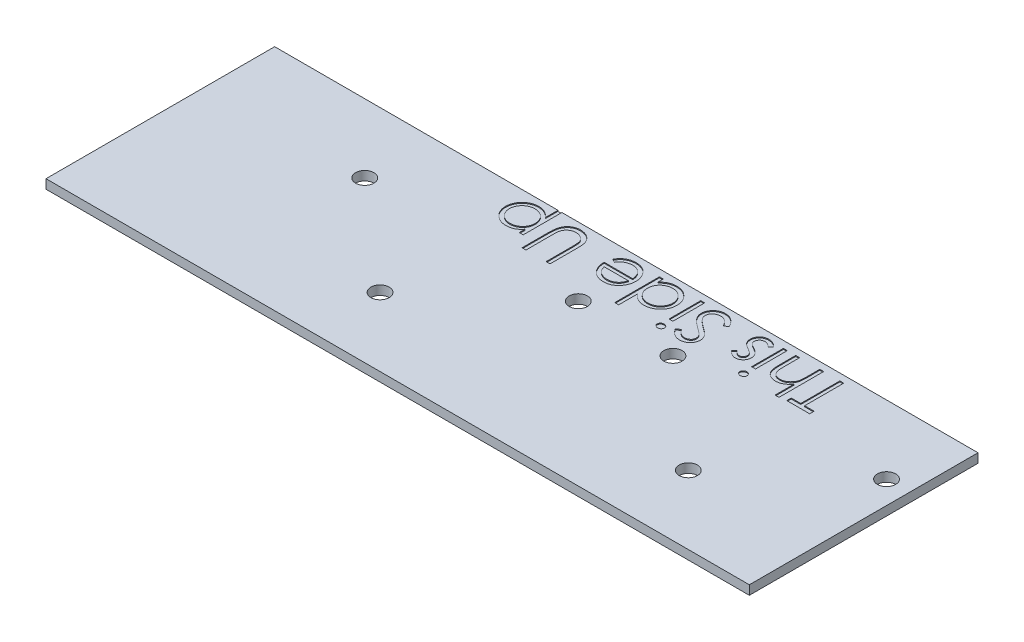
from build123d import *

# Parameters (mm, degrees)
SKETCH1_W           = 56.7
SKETCH1_H           = 50
SKETCH1_R           = 2
SKETCH1_W_2         = 8.7
SKETCH1_W_3         = 2
SKETCH1_W_4         = 29.7
BOSS_EXTRUDE1_DEPTH = 2
SKETCH2_W           = 0.854807693
SKETCH2_H           = 6.960576923
CUT_EXTRUDE1_DEPTH  = 0.2


with BuildPart() as part:
    # Sketch1 → Boss-Extrude1 (new body)
    # profile 1 of 5: a face of its own
    with BuildSketch(Plane(origin=(0, 0, 0), x_dir=(1, 0, 0), z_dir=(0, 1, 0))):
        Rectangle(SKETCH1_W, SKETCH1_H)
        with Locations(Location((23.35, 10, 0), (0, 0, 270))):
            Circle(SKETCH1_R, mode=Mode.SUBTRACT)
        with Locations(Location((0, -10, 0), (0, 0, 270))):
            Circle(SKETCH1_R, mode=Mode.SUBTRACT)
        with Locations(Location((-23.35, 10, 0), (0, 0, 270))):
            Circle(SKETCH1_R, mode=Mode.SUBTRACT)
    # profile 2 of 5: a face of its own
    with BuildSketch(Plane(origin=(0, 0, 0), x_dir=(1, 0, 0), z_dir=(0, 1, 0))):
        with Locations((32.7, 0)):
            Rectangle(SKETCH1_W_2, SKETCH1_H)
    # profile 3 of 5: a face of its own
    with BuildSketch(Plane(origin=(0, 0, 0), x_dir=(1, 0, 0), z_dir=(0, 1, 0))):
        with Locations((67.4, 0)):
            Rectangle(SKETCH1_W, SKETCH1_H)
        with Locations(Location((90.75, 10, 0), (0, 0, 270))):
            Circle(SKETCH1_R, mode=Mode.SUBTRACT)
        with Locations(Location((67.4, -10, 0), (0, 0, 270))):
            Circle(SKETCH1_R, mode=Mode.SUBTRACT)
        with Locations(Location((44.05, 10, 0), (0, 0, 270))):
            Circle(SKETCH1_R, mode=Mode.SUBTRACT)
    # profile 4 of 5: a face of its own
    with BuildSketch(Plane(origin=(0, 0, 0), x_dir=(1, 0, 0), z_dir=(0, 1, 0))):
        with Locations((38.05, 0)):
            Rectangle(SKETCH1_W_3, SKETCH1_H)
    # profile 5 of 5: a face of its own
    with BuildSketch(Plane(origin=(0, 0, 0), x_dir=(1, 0, 0), z_dir=(0, 1, 0))):
        with Locations((-43.2, 0)):
            Rectangle(SKETCH1_W_4, SKETCH1_H)
    extrude(amount=BOSS_EXTRUDE1_DEPTH)

    # Sketch2 → Cut-Extrude1 (cut)
    # profile 1 of 12: a face of its own
    with BuildSketch(Plane(origin=(0, 2, 0), x_dir=(1, 0, 0), z_dir=(0, 1, 0))):
        with BuildLine():
            Line((4.759615385, 16.539423077), (3.904807692, 16.539423077))
            Line((3.904807692, 16.539423077), (3.904807692, 17.827358774))
            add(Edge.make_bspline(
                [(3.904807692, 17.827358774), (3.813743751, 17.711435136), (3.636217432, 17.485445611), (3.334891802, 17.188412777), (3.009625504, 16.944809007), (2.665842405, 16.747320075), (2.300156627, 16.600726472), (1.916667217, 16.492715786), (1.5110623, 16.428897878), (1.233759293, 16.421222204), (1.09233774, 16.417307692)],
                knots=[0, 0, 0, 0, 1.079470681, 2.104394496, 3.089609837, 4.049760214, 5.000876222, 5.968810619, 6.964115249, 8, 8, 8, 8], degree=3))
            add(Edge.make_bspline(
                [(1.09233774, 16.417307692), (0.968807735, 16.420881415), (0.724644189, 16.427945065), (0.365243544, 16.475768878), (0.019144822, 16.557732027), (-0.311693954, 16.675844518), (-0.63081701, 16.821864047), (-0.93350001, 17.006151122), (-1.224457615, 17.21952797), (-1.496372387, 17.465088323), (-1.747618394, 17.730776677), (-1.964914073, 18.016587376), (-2.152344041, 18.313121272), (-2.303846776, 18.624975466), (-2.422523779, 18.949694227), (-2.506928009, 19.288589484), (-2.557159167, 19.640404722), (-2.563898653, 19.879625697), (-2.567307692, 20.00063101)],
                knots=[0, 0, 0, 0, 1.041296284, 2.058176809, 3.050446431, 4.034000596, 5.01514041, 6.003636468, 7.015969324, 8.052561599, 9.08815499, 10.094063707, 11.074456064, 12.040834395, 13.011057502, 13.983766392, 14.980127149, 16, 16, 16, 16], degree=3))
            add(Edge.make_bspline(
                [(-2.567307692, 20.00063101), (-2.56399116, 20.124197219), (-2.557450479, 20.367887615), (-2.506171134, 20.725618866), (-2.425575201, 21.070427212), (-2.304768233, 21.399031178), (-2.156859662, 21.716185117), (-1.971794206, 22.016529091), (-1.754652263, 22.302926359), (-1.506106127, 22.570545784), (-1.236573931, 22.817144497), (-0.948381668, 23.032673792), (-0.645829282, 23.214455158), (-0.330363027, 23.364178519), (-0.000880744, 23.479575436), (0.342439899, 23.561267019), (0.699673309, 23.612089542), (0.942705705, 23.61874781), (1.065625, 23.622115385)],
                knots=[0, 0, 0, 0, 1.038787011, 2.048637893, 3.033314735, 4.011256821, 4.987456671, 5.971770257, 6.972013799, 8.005388554, 9.039095487, 10.040396776, 11.026510796, 12.002710647, 12.972028308, 13.95670515, 14.966556032, 16, 16, 16, 16], degree=3))
            add(Edge.make_bspline(
                [(1.065625, 23.622115385), (1.204550969, 23.618419288), (1.477618712, 23.611154378), (1.878331032, 23.543578644), (2.261788631, 23.435885309), (2.627051407, 23.280379785), (2.976667424, 23.086058555), (3.305684376, 22.843506975), (3.621324961, 22.563848295), (3.80914146, 22.348478053), (3.904807692, 22.238777043)],
                knots=[0, 0, 0, 0, 1.019216655, 2.003334536, 2.974394125, 3.93700843, 4.911195144, 5.904014639, 6.932388669, 8, 8, 8, 8], degree=3))
            Line((3.904807692, 22.238777043), (3.904807692, 26.064423077))
            Line((3.904807692, 26.064423077), (4.759615385, 26.064423077))
            Line((4.759615385, 26.064423077), (4.759615385, 16.539423077))
        make_face()
        with BuildLine():
            add(Edge.make_bspline(
                [(1.099969952, 17.272115385), (1.196795901, 17.273860397), (1.387421237, 17.277295876), (1.666854766, 17.318009321), (1.935924096, 17.377302973), (2.191769227, 17.466182517), (2.436472021, 17.577873406), (2.670457039, 17.712825709), (2.889789325, 17.877102678), (3.097067483, 18.061143265), (3.286431821, 18.262918336), (3.452181652, 18.480233147), (3.591648786, 18.710095238), (3.707285781, 18.951309101), (3.795313573, 19.205606705), (3.857783765, 19.471582059), (3.897055529, 19.749514803), (3.902196056, 19.93880658), (3.904807692, 20.034975962)],
                knots=[0, 0, 0, 0, 1.056783697, 2.080534709, 3.078213817, 4.062450963, 5.032388505, 6.013014931, 7.006476528, 8.020136409, 9.037574406, 10.02408906, 10.99988041, 11.969394914, 12.94050107, 13.932990591, 14.949859205, 16, 16, 16, 16], degree=3))
            add(Edge.make_bspline(
                [(3.904807692, 20.034975962), (3.900403353, 20.161193601), (3.891774879, 20.408464646), (3.82395687, 20.769775589), (3.708014756, 21.110093649), (3.549271044, 21.429914641), (3.349503082, 21.724431521), (3.107123907, 21.987198055), (2.826300967, 22.217313825), (2.510500905, 22.41190369), (2.171449527, 22.568967654), (1.81902694, 22.685000153), (1.455642582, 22.75386247), (1.210289347, 22.762801683), (1.086613582, 22.767307692)],
                knots=[0, 0, 0, 0, 1.03769607, 2.032934487, 3.010626162, 3.986202239, 4.961259226, 5.927576439, 6.916221152, 7.938198981, 8.97036853, 9.982809098, 10.983189979, 12, 12, 12, 12], degree=3))
            add(Edge.make_bspline(
                [(1.086613582, 22.767307692), (0.965412861, 22.763071966), (0.724851219, 22.754664811), (0.37063238, 22.681901069), (0.026407892, 22.570735349), (-0.300694747, 22.408682133), (-0.607582697, 22.209918085), (-0.885776651, 21.971786645), (-1.126340846, 21.693114106), (-1.335846583, 21.386759297), (-1.501854969, 21.05709268), (-1.624862029, 20.716099874), (-1.697233019, 20.365565961), (-1.707404349, 20.128791153), (-1.7125, 20.010171274)],
                knots=[0, 0, 0, 0, 1.001026069, 1.986856787, 2.977862212, 3.984342003, 4.995015878, 5.994217425, 7.000312571, 8.029930354, 9.055188864, 10.043064731, 11.019610969, 12, 12, 12, 12], degree=3))
            add(Edge.make_bspline(
                [(-1.7125, 20.010171274), (-1.708524162, 19.890832777), (-1.700603462, 19.65308555), (-1.623166651, 19.30252143), (-1.505534891, 18.960761923), (-1.339302557, 18.633721605), (-1.132230775, 18.330337766), (-0.891448957, 18.056558666), (-0.614545132, 17.822182073), (-0.310057326, 17.623251799), (0.019951951, 17.467993435), (0.366280181, 17.353800729), (0.728388818, 17.285347886), (0.97502005, 17.276565018), (1.099969952, 17.272115385)],
                knots=[0, 0, 0, 0, 0.983964174, 1.960262275, 2.950024098, 3.962167997, 4.978769863, 5.975637987, 6.962679854, 7.964734575, 8.970044757, 9.964711476, 10.968869031, 12, 12, 12, 12], degree=3))
        make_face(mode=Mode.SUBTRACT)
    # profile 2 of 12: a face of its own
    with BuildSketch(Plane(origin=(0, 2, 0), x_dir=(1, 0, 0), z_dir=(0, 1, 0))):
        with BuildLine():
            Line((13.185576923, 13.975), (12.330769231, 13.975))
            Line((12.330769231, 13.975), (12.330769231, 19.681986178))
            add(Edge.make_bspline(
                [(12.330769231, 19.681986178), (12.330896441, 19.76276018), (12.331137845, 19.916042769), (12.329525361, 20.134215073), (12.325009508, 20.328177979), (12.322162459, 20.498679147), (12.315828787, 20.644936195), (12.310663388, 20.767741505), (12.304021588, 20.866513584), (12.296039318, 20.924155962), (12.292608173, 20.948933293)],
                knots=[0, 0, 0, 0, 1.528628734, 2.90083645, 4.128790002, 5.200304208, 6.127813768, 6.898992206, 7.526736466, 8, 8, 8, 8], degree=3))
            add(Edge.make_bspline(
                [(12.292608173, 20.948933293), (12.278692431, 21.039016706), (12.251828717, 21.212918684), (12.18019884, 21.460251276), (12.085485292, 21.684341852), (11.964781153, 21.88769417), (11.815908114, 22.071738016), (11.632228331, 22.238242846), (11.414120914, 22.387688343), (11.166545215, 22.518778605), (10.902589952, 22.627502161), (10.631914266, 22.708895306), (10.359688775, 22.758698925), (10.177413427, 22.764451217), (10.086899038, 22.767307692)],
                knots=[0, 0, 0, 0, 1.042923073, 2.013316119, 2.939979093, 3.821796737, 4.712412725, 5.640305549, 6.650442997, 7.732186751, 8.842579391, 9.91407549, 10.964170509, 12, 12, 12, 12], degree=3))
            add(Edge.make_bspline(
                [(10.086899038, 22.767307692), (10.009185101, 22.764401647), (9.854206081, 22.75860634), (9.624059569, 22.722272631), (9.399191647, 22.658094841), (9.181417359, 22.57062561), (8.974095271, 22.463233304), (8.782799364, 22.333688992), (8.609544173, 22.184991754), (8.453300428, 22.017838212), (8.317304556, 21.831204056), (8.200232715, 21.626061661), (8.104578823, 21.400774832), (8.056525724, 21.242005402), (8.031926082, 21.160727163)],
                knots=[0, 0, 0, 0, 0.994543961, 1.983343699, 2.972712664, 3.980751554, 4.981834161, 5.954730495, 6.930176574, 7.89761099, 8.875938748, 9.87834379, 10.913868493, 12, 12, 12, 12], degree=3))
            add(Edge.make_bspline(
                [(8.031926082, 21.160727163), (8.023761455, 21.1271214), (8.005567376, 21.052234217), (7.98856649, 20.925629848), (7.970859446, 20.776252365), (7.958573366, 20.603028503), (7.946595759, 20.406538713), (7.939430039, 20.185759398), (7.936117971, 19.94149224), (7.935130962, 19.771029679), (7.934615385, 19.681986178)],
                knots=[0, 0, 0, 0, 0.558680831, 1.244966039, 2.062412453, 2.990489873, 4.051219941, 5.244515665, 6.560634259, 8, 8, 8, 8], degree=3))
            Line((7.934615385, 19.681986178), (7.934615385, 13.975))
            Line((7.934615385, 13.975), (7.079807692, 13.975))
            Line((7.079807692, 13.975), (7.079807692, 19.727779447))
            add(Edge.make_bspline(
                [(7.079807692, 19.727779447), (7.080491714, 19.831462562), (7.081826624, 20.033806464), (7.093635203, 20.330294558), (7.111925571, 20.611616177), (7.139554457, 20.877417429), (7.170125586, 21.127997449), (7.213496289, 21.36243843), (7.259619824, 21.582729255), (7.317504225, 21.789276252), (7.386360952, 21.985195945), (7.468359439, 22.174188866), (7.568228933, 22.354554605), (7.681274798, 22.529599596), (7.809811551, 22.697710674), (7.952743187, 22.860192354), (8.11235739, 23.014908593), (8.284631413, 23.162599061), (8.468166574, 23.300923236), (8.665021969, 23.418694927), (8.871673841, 23.518366896), (9.085930521, 23.603260043), (9.311413267, 23.665338335), (9.545313461, 23.711945724), (9.789274963, 23.738311635), (9.95518388, 23.742240998), (10.039197716, 23.744230769)],
                knots=[0, 0, 0, 0, 1.316485072, 2.56920066, 3.767172097, 4.895413872, 5.962239305, 6.971350037, 7.921780903, 8.819233545, 9.69278517, 10.557066787, 11.431700348, 12.307563454, 13.200791052, 14.11626757, 15.05287325, 16.020813301, 16.99640464, 17.967304965, 18.928075993, 19.907403966, 20.889159767, 21.893313923, 22.933205135, 24, 24, 24, 24], degree=3))
            add(Edge.make_bspline(
                [(10.039197716, 23.744230769), (10.130826443, 23.742096567), (10.310601678, 23.737909269), (10.575490797, 23.713877822), (10.829473259, 23.668728438), (11.075027867, 23.610867298), (11.309782289, 23.532369042), (11.533667346, 23.435915622), (11.749253704, 23.325799388), (11.951684255, 23.195679696), (12.142619599, 23.053792931), (12.316136171, 22.897945876), (12.476638703, 22.734073988), (12.617052601, 22.556006663), (12.742688787, 22.367389105), (12.850778803, 22.167334155), (12.943624349, 21.956109999), (12.99153817, 21.809279057), (13.015760216, 21.735051082)],
                knots=[0, 0, 0, 0, 1.138939089, 2.234594419, 3.301501784, 4.342532435, 5.367382236, 6.373123747, 7.370098489, 8.372230273, 9.360297234, 10.323289009, 11.268038109, 12.20748145, 13.137029304, 14.081414587, 15.030090602, 16, 16, 16, 16], degree=3))
            add(Edge.make_bspline(
                [(13.015760216, 21.735051082), (13.029849483, 21.684343861), (13.060409415, 21.574358771), (13.093135403, 21.39233197), (13.120646547, 21.182741372), (13.146515245, 20.945572633), (13.161779623, 20.680641924), (13.175162081, 20.388064089), (13.185671201, 20.06748535), (13.185609227, 19.844179847), (13.185576923, 19.727779447)],
                knots=[0, 0, 0, 0, 0.625038921, 1.35572334, 2.194682327, 3.136881307, 4.189498639, 5.346923369, 6.617055217, 8, 8, 8, 8], degree=3))
            Line((13.185576923, 19.727779447), (13.185576923, 13.975))
        make_face()
    # profile 3 of 12: a face of its own
    with BuildSketch(Plane(origin=(0, 2, 0), x_dir=(1, 0, 0), z_dir=(0, 1, 0))):
        with BuildLine():
            Line((19.928635817, 21.301923077), (19.169230769, 21.70070613))
            add(Edge.make_bspline(
                [(19.169230769, 21.70070613), (19.229786542, 21.808014101), (19.347604095, 22.016792919), (19.549242508, 22.303790425), (19.762809869, 22.559555686), (19.992550372, 22.78288801), (20.235581989, 22.97903384), (20.495523958, 23.147101901), (20.768051004, 23.293024512), (21.057116056, 23.4119594), (21.362443304, 23.505574126), (21.685913746, 23.574679147), (22.029024231, 23.614760651), (22.263987035, 23.61962473), (22.38429988, 23.622115385)],
                knots=[0, 0, 0, 0, 1.120547187, 2.180141081, 3.186367408, 4.148075574, 5.090720713, 6.023293347, 6.960451315, 7.899733127, 8.862572377, 9.862522039, 10.90550313, 12, 12, 12, 12], degree=3))
            add(Edge.make_bspline(
                [(22.38429988, 23.622115385), (22.518036261, 23.618993429), (22.778917196, 23.612903397), (23.158664662, 23.560400337), (23.516204324, 23.474750545), (23.85151632, 23.355101523), (24.163778638, 23.198816949), (24.453615063, 23.008428008), (24.722537933, 22.784907944), (24.962117673, 22.52633887), (25.177669825, 22.249576425), (25.368345355, 21.961377808), (25.525909803, 21.661864544), (25.660397295, 21.355584029), (25.759906098, 21.03845996), (25.83419866, 20.713286361), (25.87582516, 20.378872444), (25.882309307, 20.152746038), (25.885576923, 20.038792067)],
                knots=[0, 0, 0, 0, 1.145213001, 2.233978795, 3.276616913, 4.289988888, 5.2768102, 6.260573508, 7.254647871, 8.264498533, 9.273731702, 10.25749501, 11.220258744, 12.169609138, 13.119022067, 14.062790212, 15.023763961, 16, 16, 16, 16], degree=3))
            add(Edge.make_bspline(
                [(25.885576923, 20.038792067), (25.882694546, 19.931853993), (25.876982054, 19.719916852), (25.840975411, 19.406229906), (25.777162557, 19.101352474), (25.689596989, 18.805031227), (25.576518241, 18.517762305), (25.438181987, 18.239370875), (25.27437273, 17.970153173), (25.147900668, 17.800327502), (25.084194712, 17.714783654)],
                knots=[0, 0, 0, 0, 1.024358464, 2.0301432, 3.019427413, 4.004406732, 4.986367066, 5.972626655, 6.978780325, 8, 8, 8, 8], degree=3))
            add(Edge.make_bspline(
                [(25.084194712, 17.714783654), (24.998053281, 17.611555353), (24.82877586, 17.408700348), (24.539496819, 17.144586185), (24.230479204, 16.918659097), (23.898614667, 16.734347331), (23.544462216, 16.592582443), (23.169848542, 16.491746952), (22.773738223, 16.429002504), (22.502200266, 16.421265231), (22.363311298, 16.417307692)],
                knots=[0, 0, 0, 0, 1.030811313, 2.025658015, 2.997072178, 3.962767568, 4.930766827, 5.917075773, 6.934604948, 8, 8, 8, 8], degree=3))
            add(Edge.make_bspline(
                [(22.363311298, 16.417307692), (22.220570679, 16.420974184), (21.940546124, 16.428167005), (21.532360383, 16.495446574), (21.145368052, 16.600844063), (20.782762782, 16.754403199), (20.438957359, 16.944750238), (20.121864427, 17.185339982), (19.822779577, 17.463815458), (19.648875162, 17.678198188), (19.560381611, 17.787289663)],
                knots=[0, 0, 0, 0, 1.056389096, 2.072394598, 3.055233004, 4.020130009, 4.981825462, 5.957811105, 6.960805292, 8, 8, 8, 8], degree=3))
            add(Edge.make_bspline(
                [(19.560381611, 17.787289663), (19.500164728, 17.869486553), (19.380131786, 18.033333204), (19.229780749, 18.300498996), (19.099268124, 18.580018542), (18.994947709, 18.876410136), (18.910475924, 19.186161994), (18.849361295, 19.511488491), (18.813521119, 19.852292749), (18.806476164, 20.084502875), (18.802884615, 20.202884615)],
                knots=[0, 0, 0, 0, 0.94817472, 1.890038105, 2.849395472, 3.817997239, 4.812318967, 5.836947057, 6.897266129, 8, 8, 8, 8], degree=3))
            Line((18.802884615, 20.202884615), (25.030769231, 20.202884615))
            add(Edge.make_bspline(
                [(25.030769231, 20.202884615), (25.026575323, 20.294596167), (25.018328173, 20.474943234), (24.979971372, 20.738868659), (24.919217989, 20.99016057), (24.834769022, 21.227748272), (24.728878732, 21.452411847), (24.603242911, 21.665699649), (24.45244009, 21.864372497), (24.284515445, 22.051004941), (24.097508391, 22.21714664), (23.900839984, 22.365966442), (23.691928908, 22.490008172), (23.472881171, 22.592209014), (23.242560777, 22.67086963), (23.001291614, 22.725038003), (22.749824226, 22.761225202), (22.578414778, 22.765255753), (22.491150841, 22.767307692)],
                knots=[0, 0, 0, 0, 1.094405546, 2.152104367, 3.174987145, 4.173015398, 5.153654967, 6.133208507, 7.119289451, 8.123438607, 9.122504012, 10.097966803, 11.060604936, 12.014205423, 12.976096155, 13.956823727, 14.959826266, 16, 16, 16, 16], degree=3))
            add(Edge.make_bspline(
                [(22.491150841, 22.767307692), (22.405825033, 22.765677754), (22.236522263, 22.762443643), (21.983874887, 22.730070823), (21.7347388, 22.679614531), (21.49234454, 22.606402754), (21.260573962, 22.519819039), (21.044132702, 22.418582342), (20.845053179, 22.304475984), (20.659341878, 22.172786154), (20.480189531, 22.012843637), (20.301901658, 21.812874202), (20.112444718, 21.574961383), (19.992211086, 21.396360743), (19.928635817, 21.301923077)],
                knots=[0, 0, 0, 0, 0.991026944, 1.966387566, 2.954903586, 3.941705208, 4.905318989, 5.827751054, 6.715113263, 7.568237245, 8.468614997, 9.499196909, 10.677664282, 12, 12, 12, 12], degree=3))
        make_face()
        with BuildLine():
            add(Edge.make_bspline(
                [(19.657692308, 19.348076923), (19.688799683, 19.23461065), (19.748515737, 19.01679227), (19.876494856, 18.715977403), (20.013942218, 18.445555034), (20.18273137, 18.212363262), (20.373749096, 18.006361574), (20.595069915, 17.82742357), (20.839382078, 17.663291172), (21.111127162, 17.526466322), (21.399802368, 17.414068765), (21.699414218, 17.331411846), (22.007469595, 17.282825899), (22.214951775, 17.275702339), (22.319426082, 17.272115385)],
                knots=[0, 0, 0, 0, 1.154958961, 2.217145986, 3.207012531, 4.129872728, 5.036522214, 5.960144231, 6.920619777, 7.92424629, 8.943461387, 9.961007416, 10.973298156, 12, 12, 12, 12], degree=3))
            add(Edge.make_bspline(
                [(22.319426082, 17.272115385), (22.404745444, 17.273767712), (22.573403885, 17.277034017), (22.821813919, 17.308426763), (23.061425922, 17.359540426), (23.291091203, 17.432672822), (23.511328528, 17.52463238), (23.723148376, 17.635305008), (23.924001182, 17.769964848), (24.049562611, 17.872745205), (24.112995793, 17.924669471)],
                knots=[0, 0, 0, 0, 1.04879286, 2.073242986, 3.073461291, 4.057960153, 5.032623303, 6.005244481, 6.992256684, 8, 8, 8, 8], degree=3))
            add(Edge.make_bspline(
                [(24.112995793, 17.924669471), (24.158432488, 17.965743255), (24.250385283, 18.048866584), (24.373120861, 18.192160599), (24.49151223, 18.34676645), (24.596720212, 18.519432827), (24.69670478, 18.705152591), (24.787816645, 18.905280895), (24.870659773, 19.120662483), (24.91716464, 19.270821965), (24.941090745, 19.348076923)],
                knots=[0, 0, 0, 0, 0.879905587, 1.780714457, 2.708106151, 3.677566983, 4.684151534, 5.740052498, 6.837288539, 8, 8, 8, 8], degree=3))
            Line((24.941090745, 19.348076923), (19.657692308, 19.348076923))
        make_face(mode=Mode.SUBTRACT)
    # profile 4 of 12: a face of its own
    with BuildSketch(Plane(origin=(0, 2, 0), x_dir=(1, 0, 0), z_dir=(0, 1, 0))):
        with BuildLine():
            Line((27.595192308, 13.730769231), (27.595192308, 23.5))
            Line((27.595192308, 23.5), (28.45, 23.5))
            Line((28.45, 23.5), (28.45, 22.29601863))
            add(Edge.make_bspline(
                [(28.45, 22.29601863), (28.546520295, 22.404833284), (28.735160977, 22.617502242), (29.047208401, 22.897050521), (29.380711144, 23.125287931), (29.729987366, 23.310548683), (30.097740581, 23.450201743), (30.481810995, 23.548585595), (30.881898099, 23.612585687), (31.154735821, 23.61891032), (31.292998798, 23.622115385)],
                knots=[0, 0, 0, 0, 1.074235403, 2.099501444, 3.086304576, 4.053325556, 5.01427503, 5.985443889, 6.979105517, 8, 8, 8, 8], degree=3))
            add(Edge.make_bspline(
                [(31.292998798, 23.622115385), (31.415920492, 23.618778454), (31.658327516, 23.612197879), (32.014908987, 23.561129646), (32.358077773, 23.479160717), (32.688052582, 23.365022208), (33.002597565, 23.214402619), (33.303485098, 23.032132112), (33.591417401, 22.817202986), (33.860918603, 22.570536413), (34.109405389, 22.3029048), (34.32680623, 22.016620204), (34.511060521, 21.715614738), (34.662484548, 21.399973002), (34.779664401, 21.069925729), (34.861189872, 20.725699339), (34.912203072, 20.367866606), (34.918780314, 20.12419015), (34.922115385, 20.00063101)],
                knots=[0, 0, 0, 0, 1.034036272, 2.039165313, 3.024406509, 3.999331371, 4.971254918, 5.953351348, 6.95522652, 7.989525907, 9.023492927, 10.024309745, 11.009187477, 11.988246066, 12.964946762, 13.950187958, 14.960617622, 16, 16, 16, 16], degree=3))
            add(Edge.make_bspline(
                [(34.922115385, 20.00063101), (34.918706343, 19.879625701), (34.911966852, 19.640404732), (34.861735729, 19.288589443), (34.777331368, 18.949694374), (34.658654851, 18.624974917), (34.507150302, 18.313123321), (34.319727254, 18.016579517), (34.102404754, 17.73080722), (33.851262272, 17.464970641), (33.579342198, 17.220305304), (33.289798943, 17.004853859), (32.98624282, 16.823050677), (32.668065158, 16.675262365), (32.337518935, 16.557820776), (31.992093168, 16.47595268), (31.633358715, 16.427827345), (31.389819292, 16.420847936), (31.266286058, 16.417307692)],
                knots=[0, 0, 0, 0, 1.02050356, 2.017480486, 2.990790918, 3.96161403, 4.928589988, 5.909588639, 6.91611943, 7.952353252, 8.989586576, 9.99823133, 10.991940466, 11.968822692, 12.952985106, 13.945868367, 14.958059758, 16, 16, 16, 16], degree=3))
            add(Edge.make_bspline(
                [(31.266286058, 16.417307692), (31.124160198, 16.421498161), (30.845182929, 16.429723584), (30.43712933, 16.500809242), (30.0497487, 16.61459306), (29.683055916, 16.776217219), (29.340269664, 16.986852055), (29.016807615, 17.240162881), (28.717625921, 17.542517997), (28.540568741, 17.770096749), (28.45, 17.886508413)],
                knots=[0, 0, 0, 0, 1.03083325, 2.023411113, 2.996083796, 3.9549903, 4.922369457, 5.908572979, 6.930187902, 8, 8, 8, 8], degree=3))
            Line((28.45, 17.886508413), (28.45, 13.730769231))
            Line((28.45, 13.730769231), (27.595192308, 13.730769231))
        make_face()
        with BuildLine():
            add(Edge.make_bspline(
                [(31.25483774, 17.272115385), (31.379787717, 17.27656497), (31.626419098, 17.285347743), (31.988526647, 17.353801281), (32.334858965, 17.467991374), (32.664852851, 17.623259575), (32.969397771, 17.822153349), (33.246090993, 18.056664531), (33.487431837, 18.329666331), (33.691492312, 18.634886489), (33.860900324, 18.960135647), (33.97780501, 19.302613155), (34.055453632, 19.653062541), (34.06334605, 19.890825087), (34.067307692, 20.010171274)],
                knots=[0, 0, 0, 0, 1.031179624, 2.035384561, 3.030098214, 4.035455833, 5.037557836, 6.024646278, 7.02156144, 8.035264006, 9.049836703, 10.039645228, 11.015989397, 12, 12, 12, 12], degree=3))
            add(Edge.make_bspline(
                [(34.067307692, 20.010171274), (34.062164992, 20.128775067), (34.05189975, 20.365517765), (33.980190489, 20.716504201), (33.854319952, 21.056747313), (33.688617668, 21.386189087), (33.481345019, 21.693685856), (33.240480511, 21.971728489), (32.962383293, 22.209854652), (32.655156668, 22.409310587), (32.327370403, 22.569756861), (31.982541714, 22.682920126), (31.626680856, 22.75437042), (31.384281957, 22.762980762), (31.262469952, 22.767307692)],
                knots=[0, 0, 0, 0, 0.979235476, 1.954632679, 2.943119654, 3.967171814, 4.992637064, 5.997548408, 6.995574264, 8.005058949, 9.015076297, 9.999929117, 10.994910263, 12, 12, 12, 12], degree=3))
            add(Edge.make_bspline(
                [(31.262469952, 22.767307692), (31.13879251, 22.762805974), (30.893435947, 22.753875274), (30.530076333, 22.684949647), (30.178107489, 22.569341668), (29.840395803, 22.411917747), (29.526323248, 22.216750376), (29.24575009, 21.987251003), (29.003361868, 21.724431326), (28.803795113, 21.42986176), (28.644343973, 21.11048743), (28.53144047, 20.769364636), (28.462866858, 20.408520452), (28.454348256, 20.16121246), (28.45, 20.034975962)],
                knots=[0, 0, 0, 0, 1.017730373, 2.019016736, 3.032373701, 4.060729657, 5.079187105, 6.068726676, 7.03591854, 8.011858086, 8.988317194, 9.965225429, 10.961364673, 12, 12, 12, 12], degree=3))
            add(Edge.make_bspline(
                [(28.45, 20.034975962), (28.452611678, 19.938806617), (28.457752285, 19.749514914), (28.49702346, 19.471581639), (28.559495812, 19.205608226), (28.647515745, 18.951303557), (28.763181957, 18.710115963), (28.902538981, 18.480154869), (29.068445235, 18.263562331), (29.255851769, 18.060612645), (29.463298187, 17.876428144), (29.683890568, 17.714089471), (29.917073902, 17.576706284), (30.162684508, 17.466763799), (30.418830676, 17.377196414), (30.687967518, 17.318038704), (30.967382629, 17.277288172), (31.158010502, 17.273857802), (31.25483774, 17.272115385)],
                knots=[0, 0, 0, 0, 1.050062701, 2.066855696, 3.059271411, 4.030305351, 4.999747758, 5.975466543, 6.961907836, 7.974539719, 8.98812422, 9.98710676, 10.961662635, 11.93785114, 12.922015094, 13.919620009, 14.94329489, 16, 16, 16, 16], degree=3))
        make_face(mode=Mode.SUBTRACT)
    # profile 5 of 12: a face of its own
    with BuildSketch(Plane(origin=(0, 2, 0), x_dir=(1, 0, 0), z_dir=(0, 1, 0))):
        with BuildLine():
            add(Edge.make_bspline(
                [(37.062950721, 13.608653846), (37.009915354, 13.611125106), (36.906061919, 13.615964306), (36.755731584, 13.657073579), (36.618983073, 13.727819219), (36.495880365, 13.819648785), (36.393833878, 13.932084929), (36.320661116, 14.059837242), (36.273947847, 14.198915523), (36.268273633, 14.295822306), (36.265384615, 14.34516226)],
                knots=[0, 0, 0, 0, 1.054986045, 2.065865298, 3.074122704, 4.105114675, 5.109626121, 6.074217918, 7.019490725, 8, 8, 8, 8], degree=3))
            add(Edge.make_bspline(
                [(36.265384615, 14.34516226), (36.268338263, 14.393221502), (36.274177274, 14.488228936), (36.320626583, 14.624895776), (36.394447345, 14.750869166), (36.495812443, 14.863085489), (36.619001012, 14.954862005), (36.755726838, 15.025621661), (36.906063168, 15.06672723), (37.009915776, 15.071566941), (37.062950721, 15.074038462)],
                knots=[0, 0, 0, 0, 0.961106377, 1.899993565, 2.859409042, 3.870007927, 4.90724781, 5.921615355, 6.938620636, 8, 8, 8, 8], degree=3))
            add(Edge.make_bspline(
                [(37.062950721, 15.074038462), (37.115376548, 15.071646318), (37.21741657, 15.066990323), (37.364982772, 15.025129868), (37.499530951, 14.955015877), (37.620620469, 14.861815425), (37.723995275, 14.75161533), (37.797543659, 14.62480062), (37.844117159, 14.488253163), (37.849939434, 14.39322964), (37.852884615, 14.34516226)],
                knots=[0, 0, 0, 0, 1.055304112, 2.054011575, 3.063363921, 4.096942562, 5.122536081, 6.088009498, 7.032825006, 8, 8, 8, 8], degree=3))
            add(Edge.make_bspline(
                [(37.852884615, 14.34516226), (37.850004378, 14.295813858), (37.844347411, 14.198890485), (37.797507511, 14.059934026), (37.72461631, 13.931332399), (37.620553675, 13.820917928), (37.499548437, 13.727665685), (37.364978219, 13.657565237), (37.217417778, 13.615701242), (37.115376958, 13.611045738), (37.062950721, 13.608653846)],
                knots=[0, 0, 0, 0, 0.986662878, 1.937868148, 2.908513651, 3.927890639, 4.955204348, 5.958438607, 6.951092507, 8, 8, 8, 8], degree=3))
        make_face()
    # profile 6 of 12: a face of its own
    with BuildSketch(Plane(origin=(0, 2, 0), x_dir=(1, 0, 0), z_dir=(0, 1, 0))):
        with Locations((37.059134615, 20.019711539)):
            Rectangle(SKETCH2_W, SKETCH2_H)
    # profile 7 of 12: a face of its own
    with BuildSketch(Plane(origin=(0, 2, 0), x_dir=(1, 0, 0), z_dir=(0, 1, 0))):
        with BuildLine():
            Line((44.691346154, 21.662545072), (43.886147837, 21.179807692))
            add(Edge.make_bspline(
                [(43.886147837, 21.179807692), (43.811258919, 21.305168626), (43.667774644, 21.545355336), (43.428421303, 21.869907575), (43.180409594, 22.145757444), (42.921902908, 22.371300212), (42.654479149, 22.548870396), (42.376392546, 22.67460647), (42.088580218, 22.753027089), (41.892708604, 22.762552324), (41.794921875, 22.767307692)],
                knots=[0, 0, 0, 0, 1.272034388, 2.437168799, 3.508375237, 4.49857839, 5.41946034, 6.295179144, 7.148887113, 8, 8, 8, 8], degree=3))
            add(Edge.make_bspline(
                [(41.794921875, 22.767307692), (41.711426674, 22.76492643), (41.545897243, 22.760205572), (41.301733794, 22.71667682), (41.065788152, 22.645464104), (40.840408628, 22.548926734), (40.631555868, 22.430264236), (40.44550376, 22.29032868), (40.288302642, 22.128674281), (40.158339954, 21.951129629), (40.056603011, 21.761400806), (39.984214752, 21.564160325), (39.937714104, 21.360665053), (39.931818488, 21.222667702), (39.928846154, 21.153094952)],
                knots=[0, 0, 0, 0, 1.095645842, 2.172120455, 3.244862764, 4.326153987, 5.384857088, 6.392105572, 7.372507978, 8.334705661, 9.272564127, 10.189475455, 11.087205874, 12, 12, 12, 12], degree=3))
            add(Edge.make_bspline(
                [(39.928846154, 21.153094952), (39.932772211, 21.073763741), (39.940722905, 20.913109389), (40.010792898, 20.675677219), (40.117786846, 20.439695992), (40.218349132, 20.293698907), (40.27038762, 20.218149038)],
                knots=[0, 0, 0, 0, 0.938992559, 1.901562324, 2.914110574, 4, 4, 4, 4], degree=3))
            add(Edge.make_bspline(
                [(40.27038762, 20.218149038), (40.312907078, 20.163474601), (40.402433385, 20.048355529), (40.558608735, 19.880006021), (40.736189949, 19.701754962), (40.939774668, 19.517160214), (41.16639419, 19.322445746), (41.418617742, 19.121222773), (41.693500221, 18.910490135), (41.88738284, 18.771307287), (41.987635216, 18.699338942)],
                knots=[0, 0, 0, 0, 0.722283655, 1.520795216, 2.39349503, 3.346893347, 4.386874146, 5.510198126, 6.712579003, 8, 8, 8, 8], degree=3))
            add(Edge.make_bspline(
                [(41.987635216, 18.699338942), (42.087835724, 18.627943377), (42.279411465, 18.491440492), (42.547532279, 18.289111335), (42.786969851, 18.102946154), (42.998944235, 17.935538164), (43.177971383, 17.779585875), (43.330596029, 17.643447458), (43.451187272, 17.519853278), (43.518293454, 17.439739945), (43.548422476, 17.403771034)],
                knots=[0, 0, 0, 0, 1.452255772, 2.776602448, 3.96446981, 5.032613149, 5.964194703, 6.766668629, 7.446264616, 8, 8, 8, 8], degree=3))
            add(Edge.make_bspline(
                [(43.548422476, 17.403771034), (43.590522845, 17.347704), (43.673318871, 17.237440655), (43.782728357, 17.065146236), (43.874993674, 16.889110395), (43.949250004, 16.708695139), (44.009298285, 16.525256396), (44.051047245, 16.337416979), (44.076780421, 16.146452054), (44.079438584, 16.017968333), (44.080769231, 15.953650841)],
                knots=[0, 0, 0, 0, 1.068019517, 2.100403715, 3.106014851, 4.09224787, 5.069873182, 6.043214339, 7.020455327, 8, 8, 8, 8], degree=3))
            add(Edge.make_bspline(
                [(44.080769231, 15.953650841), (44.07723285, 15.85286832), (44.070235676, 15.653457434), (44.010571176, 15.362305948), (43.917510619, 15.083472344), (43.782873326, 14.82316245), (43.61657108, 14.581745273), (43.419169997, 14.363503348), (43.186973313, 14.175948828), (42.928479107, 14.016512494), (42.648841653, 13.88931786), (42.354959088, 13.796635881), (42.048151965, 13.742318584), (41.839656137, 13.734656842), (41.733864183, 13.730769231)],
                knots=[0, 0, 0, 0, 1.005367131, 1.989245246, 2.955191616, 3.932180104, 4.904534562, 5.875498653, 6.859376768, 7.874484044, 8.900379497, 9.918679785, 10.943926428, 12, 12, 12, 12], degree=3))
            add(Edge.make_bspline(
                [(41.733864183, 13.730769231), (41.621586622, 13.734515823), (41.398926793, 13.741945762), (41.071308911, 13.810520331), (40.753996216, 13.917067308), (40.499694993, 14.043962704), (40.300593608, 14.169335154), (40.148917063, 14.283819009), (39.994376763, 14.41533317), (39.838637818, 14.566663717), (39.680161491, 14.734779889), (39.519678136, 14.921105989), (39.355685793, 15.123962569), (39.250220416, 15.268815443), (39.196153846, 15.343073918)],
                knots=[0, 0, 0, 0, 1.286534051, 2.551350862, 3.822568981, 5.117864672, 5.799956111, 6.519305446, 7.295594771, 8.126302591, 9.008831062, 9.944975596, 10.946496709, 12, 12, 12, 12], degree=3))
            Line((39.196153846, 15.343073918), (39.968915264, 15.928846154))
            add(Edge.make_bspline(
                [(39.968915264, 15.928846154), (40.015573293, 15.86872988), (40.105425746, 15.752959992), (40.241894823, 15.590887211), (40.370325274, 15.442639757), (40.497828728, 15.31421427), (40.614576809, 15.195992321), (40.72990141, 15.09657489), (40.839347374, 15.01280578), (40.976987859, 14.923291322), (41.151791665, 14.836685423), (41.369176694, 14.762224993), (41.596500156, 14.716464643), (41.750825035, 14.710648563), (41.829266827, 14.707692308)],
                knots=[0, 0, 0, 0, 1.181426797, 2.275151783, 3.28963443, 4.225459815, 5.084396437, 5.868484344, 6.587427557, 7.222918358, 8.415355282, 9.605213164, 10.782753814, 12, 12, 12, 12], degree=3))
            add(Edge.make_bspline(
                [(41.829266827, 14.707692308), (41.927687441, 14.710935867), (42.117482322, 14.717190765), (42.386307734, 14.787301225), (42.629661815, 14.893899456), (42.838254567, 15.047612993), (43.010486368, 15.230869136), (43.136618312, 15.439859861), (43.212030385, 15.670681985), (43.221260692, 15.831619064), (43.225961538, 15.913581731)],
                knots=[0, 0, 0, 0, 1.144248881, 2.206576175, 3.214949548, 4.222996039, 5.203671638, 6.127710127, 7.046472867, 8, 8, 8, 8], degree=3))
            add(Edge.make_bspline(
                [(43.225961538, 15.913581731), (43.224779997, 15.964587428), (43.222400456, 16.067309353), (43.194030542, 16.218762014), (43.151694393, 16.368431727), (43.091684072, 16.517180809), (43.010129336, 16.669246991), (42.899363687, 16.823763527), (42.760755143, 16.98459756), (42.654376735, 17.089101113), (42.598212139, 17.144275841)],
                knots=[0, 0, 0, 0, 0.858500039, 1.728959331, 2.587258638, 3.476905708, 4.426389682, 5.487945037, 6.673710648, 8, 8, 8, 8], degree=3))
            add(Edge.make_bspline(
                [(42.598212139, 17.144275841), (42.577362262, 17.162882319), (42.527827725, 17.20708705), (42.43726967, 17.279456042), (42.317682483, 17.368726444), (42.172188921, 17.479181927), (41.998106315, 17.607310763), (41.795415523, 17.751474665), (41.566375923, 17.916353664), (41.403846995, 18.031626685), (41.317908654, 18.092578125)],
                knots=[0, 0, 0, 0, 0.420754252, 0.999615792, 1.744751191, 2.668019286, 3.750313428, 4.999500688, 6.413464383, 8, 8, 8, 8], degree=3))
            add(Edge.make_bspline(
                [(41.317908654, 18.092578125), (41.214532777, 18.167802164), (41.014359719, 18.313463089), (40.729540605, 18.5323079), (40.471297262, 18.746344646), (40.238703911, 18.95419258), (40.029526687, 19.154321569), (39.845874219, 19.348984187), (39.68691323, 19.536903865), (39.513443245, 19.776190246), (39.338289982, 20.072794475), (39.188110454, 20.436354403), (39.092568811, 20.800957636), (39.080160587, 21.045698164), (39.074038462, 21.166451322)],
                knots=[0, 0, 0, 0, 1.163604038, 2.253157948, 3.268574773, 4.215621239, 5.091738613, 5.902582348, 6.650434646, 7.330118262, 8.591011492, 9.77460283, 10.902005569, 12, 12, 12, 12], degree=3))
            add(Edge.make_bspline(
                [(39.074038462, 21.166451322), (39.075829633, 21.251843723), (39.079377193, 21.420970263), (39.120051288, 21.669337385), (39.179856435, 21.910454617), (39.268988814, 22.141321363), (39.380406875, 22.364510651), (39.516057474, 22.579631148), (39.680450554, 22.783148192), (39.863071543, 22.979014141), (40.065917256, 23.156155528), (40.280569438, 23.313932578), (40.505823294, 23.44902481), (40.744251183, 23.555156267), (40.991925549, 23.640052357), (41.250008994, 23.700903641), (41.519056089, 23.738377823), (41.701940045, 23.742258007), (41.794921875, 23.744230769)],
                knots=[0, 0, 0, 0, 0.98378539, 1.948466333, 2.894822735, 3.844243623, 4.795447569, 5.768042124, 6.770299647, 7.807997672, 8.852593179, 9.870666288, 10.876941106, 11.874841786, 12.874492863, 13.892063892, 14.928283473, 16, 16, 16, 16], degree=3))
            add(Edge.make_bspline(
                [(41.794921875, 23.744230769), (41.866860597, 23.742823685), (42.009832048, 23.740027236), (42.220736499, 23.715890531), (42.427768091, 23.680493746), (42.628327356, 23.626526517), (42.824911386, 23.559507625), (43.015768765, 23.477453305), (43.201359895, 23.379769497), (43.381914032, 23.266305104), (43.559083759, 23.135507301), (43.732154041, 22.984487453), (43.901991262, 22.813968434), (44.069300906, 22.624187537), (44.230141783, 22.412007819), (44.388558559, 22.180794202), (44.543726353, 21.929799721), (44.641220478, 21.753293874), (44.691346154, 21.662545072)],
                knots=[0, 0, 0, 0, 0.915366252, 1.81920441, 2.69897508, 3.586533125, 4.459536084, 5.340758185, 6.227946952, 7.126403341, 8.052553006, 9.028121456, 10.047063623, 11.114014537, 12.24582441, 13.433687931, 14.680555077, 16, 16, 16, 16], degree=3))
        make_face()
    # profile 8 of 12: a face of its own
    with BuildSketch(Plane(origin=(0, 2, 0), x_dir=(1, 0, 0), z_dir=(0, 1, 0))):
        with BuildLine():
            Line((49.453846154, 17.407587139), (50.033894231, 18.004807692))
            add(Edge.make_bspline(
                [(50.033894231, 18.004807692), (50.083934462, 17.946792947), (50.180406136, 17.834947348), (50.333545648, 17.685607357), (50.486042967, 17.559147927), (50.63709378, 17.455093455), (50.786979971, 17.373201625), (50.936981282, 17.315362287), (51.086686089, 17.279050961), (51.186804691, 17.274399478), (51.235967548, 17.272115385)],
                knots=[0, 0, 0, 0, 1.265880991, 2.440469525, 3.530740057, 4.536711111, 5.468008477, 6.34654737, 7.188078389, 8, 8, 8, 8], degree=3))
            add(Edge.make_bspline(
                [(51.235967548, 17.272115385), (51.296194935, 17.27507672), (51.414713909, 17.280904208), (51.584410243, 17.337662084), (51.740021502, 17.427264458), (51.877733878, 17.549434841), (51.992712475, 17.694211565), (52.078891416, 17.854727737), (52.130461128, 18.028408655), (52.137045229, 18.14820825), (52.140384615, 18.208969351)],
                knots=[0, 0, 0, 0, 0.999905305, 1.967672129, 2.944835807, 3.972828834, 5.013019963, 6.007753697, 6.989553527, 8, 8, 8, 8], degree=3))
            add(Edge.make_bspline(
                [(52.140384615, 18.208969351), (52.137361619, 18.263974985), (52.131324148, 18.373831194), (52.084388543, 18.535886915), (52.009641589, 18.693884997), (51.939781989, 18.790666907), (51.903786058, 18.840534856)],
                knots=[0, 0, 0, 0, 0.960159726, 1.917612774, 2.927026955, 4, 4, 4, 4], degree=3))
            add(Edge.make_bspline(
                [(51.903786058, 18.840534856), (51.882002498, 18.867044958), (51.835358201, 18.923810019), (51.750753851, 19.004594426), (51.650531403, 19.089065609), (51.533739337, 19.176650488), (51.400142903, 19.267440815), (51.251699948, 19.362978842), (51.086575827, 19.460467937), (50.97028607, 19.524563967), (50.909690505, 19.55796274)],
                knots=[0, 0, 0, 0, 0.667332049, 1.428932371, 2.272176193, 3.217953793, 4.268659351, 5.415594948, 6.6533338, 8, 8, 8, 8], degree=3))
            add(Edge.make_bspline(
                [(50.909690505, 19.55796274), (50.835617443, 19.599433208), (50.69253268, 19.679540496), (50.48944003, 19.804170975), (50.304033715, 19.927212092), (50.138873711, 20.05147704), (49.99008734, 20.17185424), (49.860065449, 20.291671453), (49.748405337, 20.411245368), (49.685951548, 20.494900276), (49.65609976, 20.534885817)],
                knots=[0, 0, 0, 0, 1.271974443, 2.457035787, 3.569878245, 4.604907449, 5.553098313, 6.436573686, 7.252710343, 8, 8, 8, 8], degree=3))
            add(Edge.make_bspline(
                [(49.65609976, 20.534885817), (49.606219409, 20.615506341), (49.506757302, 20.77626478), (49.408100945, 21.042456953), (49.343253001, 21.32170332), (49.335621242, 21.513337501), (49.331730769, 21.611027644)],
                knots=[0, 0, 0, 0, 0.995678878, 1.985397446, 2.973007791, 4, 4, 4, 4], degree=3))
            add(Edge.make_bspline(
                [(49.331730769, 21.611027644), (49.333684594, 21.679797928), (49.337534818, 21.815317284), (49.364425064, 22.014862546), (49.410338083, 22.2058399), (49.473933987, 22.389403692), (49.555639284, 22.565059361), (49.65748912, 22.731563028), (49.777662349, 22.888881621), (49.911478318, 23.039078108), (50.06092341, 23.175547247), (50.222258373, 23.293720342), (50.390616168, 23.396527952), (50.569697521, 23.478282254), (50.75725246, 23.543985588), (50.954348891, 23.589275603), (51.160157812, 23.616430971), (51.300121651, 23.620196622), (51.371439303, 23.622115385)],
                knots=[0, 0, 0, 0, 1.032810722, 2.035266353, 3.017676364, 3.978389067, 4.948507077, 5.921677479, 6.903715858, 7.918386526, 8.939467451, 9.936812204, 10.918153393, 11.89693397, 12.887853058, 13.89815236, 14.929017384, 16, 16, 16, 16], degree=3))
            add(Edge.make_bspline(
                [(51.371439303, 23.622115385), (51.467693321, 23.619426058), (51.658863916, 23.614084772), (51.941521878, 23.563541276), (52.218304507, 23.485802132), (52.485234917, 23.374967472), (52.738235313, 23.238706418), (52.97108581, 23.077487463), (53.181363755, 22.892162811), (53.301480226, 22.750412443), (53.361538462, 22.67953726)],
                knots=[0, 0, 0, 0, 1.014105853, 2.01412079, 3.018242674, 4.040740662, 5.055023907, 6.042888753, 7.021444376, 8, 8, 8, 8], degree=3))
            Line((53.361538462, 22.67953726), (52.794846755, 22.034615385))
            add(Edge.make_bspline(
                [(52.794846755, 22.034615385), (52.741037545, 22.092730851), (52.636720256, 22.20539647), (52.469893373, 22.355413425), (52.300132289, 22.481146885), (52.129132178, 22.586312178), (51.954361778, 22.667343811), (51.776800499, 22.72427227), (51.596809502, 22.760859679), (51.475917833, 22.765154861), (51.415324519, 22.767307692)],
                knots=[0, 0, 0, 0, 1.179806542, 2.287233372, 3.337373186, 4.324005949, 5.273901747, 6.200048787, 7.097828587, 8, 8, 8, 8], degree=3))
            add(Edge.make_bspline(
                [(51.415324519, 22.767307692), (51.332817059, 22.763576758), (51.171611323, 22.756287138), (50.940706513, 22.690114584), (50.72754568, 22.586329134), (50.542302575, 22.439208182), (50.38553912, 22.268043806), (50.269738537, 22.07594235), (50.199571722, 21.866337796), (50.190921363, 21.720946481), (50.186538462, 21.647280649)],
                knots=[0, 0, 0, 0, 1.072236613, 2.094970478, 3.102399718, 4.141104368, 5.155589565, 6.110053346, 7.042415349, 8, 8, 8, 8], degree=3))
            add(Edge.make_bspline(
                [(50.186538462, 21.647280649), (50.189403461, 21.586539565), (50.195030914, 21.467231501), (50.241981629, 21.294137463), (50.312994236, 21.129003746), (50.384822934, 21.032294742), (50.421228966, 20.983278245)],
                knots=[0, 0, 0, 0, 1.014054094, 1.991812201, 2.982159616, 4, 4, 4, 4], degree=3))
            add(Edge.make_bspline(
                [(50.421228966, 20.983278245), (50.443056615, 20.95868241), (50.490605117, 20.905103797), (50.57793379, 20.827879159), (50.681665051, 20.744110014), (50.806406194, 20.658863981), (50.94586364, 20.564428198), (51.107485851, 20.470778348), (51.285008672, 20.368640297), (51.41068637, 20.301136698), (51.476382212, 20.265850361)],
                knots=[0, 0, 0, 0, 0.615029206, 1.339755737, 2.178261527, 3.109653826, 4.166232585, 5.329982127, 6.604294388, 8, 8, 8, 8], degree=3))
            add(Edge.make_bspline(
                [(51.476382212, 20.265850361), (51.547266282, 20.226283152), (51.684733116, 20.149549708), (51.879443958, 20.030035232), (52.055104972, 19.908476435), (52.215942964, 19.791692208), (52.357895415, 19.673525211), (52.480403103, 19.553844262), (52.588289283, 19.437476014), (52.648017597, 19.355024085), (52.676547476, 19.315640024)],
                knots=[0, 0, 0, 0, 1.262093308, 2.447601706, 3.550203992, 4.582594899, 5.537233252, 6.418365656, 7.244515135, 8, 8, 8, 8], degree=3))
            add(Edge.make_bspline(
                [(52.676547476, 19.315640024), (52.7258171, 19.236297538), (52.824059255, 19.078090994), (52.921143062, 18.813697412), (52.986034694, 18.534598799), (52.992100805, 18.341648532), (52.995192308, 18.243314303)],
                knots=[0, 0, 0, 0, 0.984940175, 1.963941237, 2.962352981, 4, 4, 4, 4], degree=3))
            add(Edge.make_bspline(
                [(52.995192308, 18.243314303), (52.993740251, 18.179018768), (52.990898371, 18.053183298), (52.96816644, 17.868302531), (52.926911563, 17.692603287), (52.874563312, 17.52310364), (52.803328541, 17.362919689), (52.716967318, 17.210385667), (52.613552222, 17.067973452), (52.497186824, 16.934706738), (52.370749386, 16.812317233), (52.232136236, 16.707623383), (52.087123516, 16.616829243), (51.9325391, 16.544111601), (51.770357459, 16.486320404), (51.599315303, 16.447175684), (51.420595368, 16.420844977), (51.298396458, 16.418503768), (51.235967548, 16.417307692)],
                knots=[0, 0, 0, 0, 1.087410352, 2.12821612, 3.143409386, 4.13688077, 5.124334423, 6.102425883, 7.096654197, 8.095527921, 9.09231389, 10.067027194, 11.028349958, 11.981147348, 12.950860869, 13.934615631, 14.944837612, 16, 16, 16, 16], degree=3))
            add(Edge.make_bspline(
                [(51.235967548, 16.417307692), (51.161962658, 16.420306041), (51.012564623, 16.426358985), (50.788499038, 16.4746535), (50.565017338, 16.553302233), (50.341890473, 16.664477056), (50.118167826, 16.804309066), (49.894852205, 16.976423214), (49.668315424, 17.175961172), (49.526933253, 17.328653361), (49.453846154, 17.407587139)],
                knots=[0, 0, 0, 0, 0.845753203, 1.707371858, 2.609134499, 3.549244224, 4.552329203, 5.621587647, 6.770486714, 8, 8, 8, 8], degree=3))
        make_face()
    # profile 9 of 12: a face of its own
    with BuildSketch(Plane(origin=(0, 2, 0), x_dir=(1, 0, 0), z_dir=(0, 1, 0))):
        with BuildLine():
            add(Edge.make_bspline(
                [(55.136027644, 13.608653846), (55.082992277, 13.611125106), (54.979138842, 13.615964306), (54.828808507, 13.657073579), (54.692059996, 13.727819219), (54.568957288, 13.819648785), (54.466910801, 13.932084929), (54.393738039, 14.059837242), (54.34702477, 14.198915523), (54.341350556, 14.295822306), (54.338461538, 14.34516226)],
                knots=[0, 0, 0, 0, 1.054986045, 2.065865298, 3.074122704, 4.105114675, 5.109626121, 6.074217918, 7.019490725, 8, 8, 8, 8], degree=3))
            add(Edge.make_bspline(
                [(54.338461538, 14.34516226), (54.341415186, 14.393221502), (54.347254197, 14.488228936), (54.393703507, 14.624895776), (54.467524268, 14.750869166), (54.568889366, 14.863085489), (54.692077935, 14.954862005), (54.828803761, 15.025621661), (54.979140091, 15.06672723), (55.082992699, 15.071566941), (55.136027644, 15.074038462)],
                knots=[0, 0, 0, 0, 0.961106377, 1.899993565, 2.859409042, 3.870007927, 4.90724781, 5.921615355, 6.938620636, 8, 8, 8, 8], degree=3))
            add(Edge.make_bspline(
                [(55.136027644, 15.074038462), (55.188453471, 15.071646318), (55.290493493, 15.066990323), (55.438059695, 15.025129868), (55.572607874, 14.955015877), (55.693697392, 14.861815425), (55.797072198, 14.75161533), (55.870620582, 14.62480062), (55.917194082, 14.488253163), (55.923016357, 14.39322964), (55.925961538, 14.34516226)],
                knots=[0, 0, 0, 0, 1.055304112, 2.054011575, 3.063363921, 4.096942562, 5.122536081, 6.088009498, 7.032825006, 8, 8, 8, 8], degree=3))
            add(Edge.make_bspline(
                [(55.925961538, 14.34516226), (55.923081301, 14.295813858), (55.917424334, 14.198890485), (55.870584434, 14.059934026), (55.797693233, 13.931332399), (55.693630598, 13.820917928), (55.57262536, 13.727665685), (55.438055142, 13.657565237), (55.290494701, 13.615701242), (55.188453881, 13.611045738), (55.136027644, 13.608653846)],
                knots=[0, 0, 0, 0, 0.986662878, 1.937868148, 2.908513651, 3.927890639, 4.955204348, 5.958438607, 6.951092507, 8, 8, 8, 8], degree=3))
        make_face()
    # profile 10 of 12: a face of its own
    with BuildSketch(Plane(origin=(0, 2, 0), x_dir=(1, 0, 0), z_dir=(0, 1, 0))):
        with Locations((55.132211539, 20.019711539)):
            Rectangle(SKETCH2_W, SKETCH2_H)
    # profile 11 of 12: a face of its own
    with BuildSketch(Plane(origin=(0, 2, 0), x_dir=(1, 0, 0), z_dir=(0, 1, 0))):
        with BuildLine():
            Line((63.497115385, 13.730769231), (62.642307692, 13.730769231))
            Line((62.642307692, 13.730769231), (62.642307692, 17.854071514))
            add(Edge.make_bspline(
                [(62.642307692, 17.854071514), (62.55040236, 17.739539155), (62.371741907, 17.516892627), (62.073076356, 17.223252891), (61.761864665, 16.973141666), (61.435465785, 16.768901871), (61.095266919, 16.610461399), (60.740432115, 16.499615537), (60.371865999, 16.430494519), (60.120799244, 16.421734368), (59.993930288, 16.417307692)],
                knots=[0, 0, 0, 0, 1.12556596, 2.18805719, 3.205172764, 4.182516927, 5.13416184, 6.075333115, 7.027428072, 8, 8, 8, 8], degree=3))
            add(Edge.make_bspline(
                [(59.993930288, 16.417307692), (59.86506188, 16.421788824), (59.612708884, 16.430563875), (59.246606516, 16.507883193), (58.902285309, 16.630242349), (58.584344717, 16.802209114), (58.297694151, 17.015727613), (58.049071146, 17.266148034), (57.840503985, 17.550172106), (57.700957099, 17.814915699), (57.609497809, 18.050349324), (57.551684008, 18.252396401), (57.502639471, 18.477512769), (57.45991578, 18.725612737), (57.431439275, 18.997878018), (57.408566891, 19.293083105), (57.392302344, 19.611210218), (57.391672057, 19.831428903), (57.391346154, 19.945297476)],
                knots=[0, 0, 0, 0, 1.235689485, 2.419754739, 3.574485241, 4.732583367, 5.875375667, 6.993392835, 8.106934443, 9.24564317, 9.854426656, 10.528623913, 11.260290605, 12.06517837, 12.94359002, 13.886555271, 14.907200199, 16, 16, 16, 16], degree=3))
            Line((57.391346154, 19.945297476), (57.391346154, 23.5))
            Line((57.391346154, 23.5), (58.246153846, 23.5))
            Line((58.246153846, 23.5), (58.246153846, 20.22578125))
            add(Edge.make_bspline(
                [(58.246153846, 20.22578125), (58.246669672, 20.13101372), (58.247656359, 19.949739565), (58.250958046, 19.690209093), (58.258160818, 19.45544572), (58.270230462, 19.244962114), (58.282375345, 19.059043525), (58.299593622, 18.897386275), (58.319477167, 18.761004491), (58.337354787, 18.678913687), (58.345372596, 18.642097356)],
                knots=[0, 0, 0, 0, 1.430934443, 2.737134061, 3.918973087, 4.976914145, 5.92044225, 6.731742364, 7.431207999, 8, 8, 8, 8], degree=3))
            add(Edge.make_bspline(
                [(58.345372596, 18.642097356), (58.376318524, 18.533992951), (58.435654714, 18.326711923), (58.576325902, 18.045652609), (58.747934718, 17.8038467), (58.960642007, 17.608162217), (59.207381554, 17.453974842), (59.490495823, 17.3489269), (59.80636713, 17.281936682), (60.02854066, 17.275486677), (60.144666466, 17.272115385)],
                knots=[0, 0, 0, 0, 1.090171874, 2.090312098, 3.036871164, 3.954896932, 4.878889889, 5.844924892, 6.87358393, 8, 8, 8, 8], degree=3))
            add(Edge.make_bspline(
                [(60.144666466, 17.272115385), (60.21343702, 17.273391672), (60.349532169, 17.275917413), (60.55123332, 17.301917312), (60.747500439, 17.342980645), (60.937806747, 17.403634845), (61.122540445, 17.477378885), (61.302452457, 17.567877574), (61.475080574, 17.677300229), (61.642652925, 17.800454341), (61.798646307, 17.936695343), (61.943770222, 18.080519803), (62.073142948, 18.233666726), (62.190350902, 18.393687403), (62.291528988, 18.562774546), (62.379847723, 18.739298181), (62.454784157, 18.923490299), (62.492020626, 19.051329575), (62.510652043, 19.115294471)],
                knots=[0, 0, 0, 0, 1.024369801, 2.02720137, 3.025498567, 4.008789058, 4.999724648, 5.987391013, 7.005161842, 8.042127274, 9.083588116, 10.088924978, 11.084112559, 12.068088063, 13.041783903, 14.016724555, 15.007660144, 16, 16, 16, 16], degree=3))
            add(Edge.make_bspline(
                [(62.510652043, 19.115294471), (62.521372913, 19.161615773), (62.544735008, 19.262555592), (62.570084661, 19.429037145), (62.592775379, 19.622493629), (62.611957504, 19.84263162), (62.623722475, 20.090257786), (62.636399544, 20.363682325), (62.64111854, 20.664617953), (62.641899461, 20.873883584), (62.642307692, 20.983278245)],
                knots=[0, 0, 0, 0, 0.607992626, 1.324890765, 2.152360218, 3.099583803, 4.150613268, 5.323148443, 6.60066238, 8, 8, 8, 8], degree=3))
            Line((62.642307692, 20.983278245), (62.642307692, 23.5))
            Line((62.642307692, 23.5), (63.497115385, 23.5))
            Line((63.497115385, 23.5), (63.497115385, 13.730769231))
        make_face()
    # profile 12 of 12: a face of its own
    with BuildSketch(Plane(origin=(0, 2, 0), x_dir=(1, 0, 0), z_dir=(0, 1, 0))):
        Polygon((69.969230769, 14.951923077), (69.969230769, 13.975), (64.9625, 13.975), (64.9625, 14.951923077), (67.038461538, 14.951923077), (67.038461538, 23.5), (67.893269231, 23.5), (67.893269231, 14.951923077), align=None)
    extrude(amount=-CUT_EXTRUDE1_DEPTH, mode=Mode.SUBTRACT)


solid = part.part
